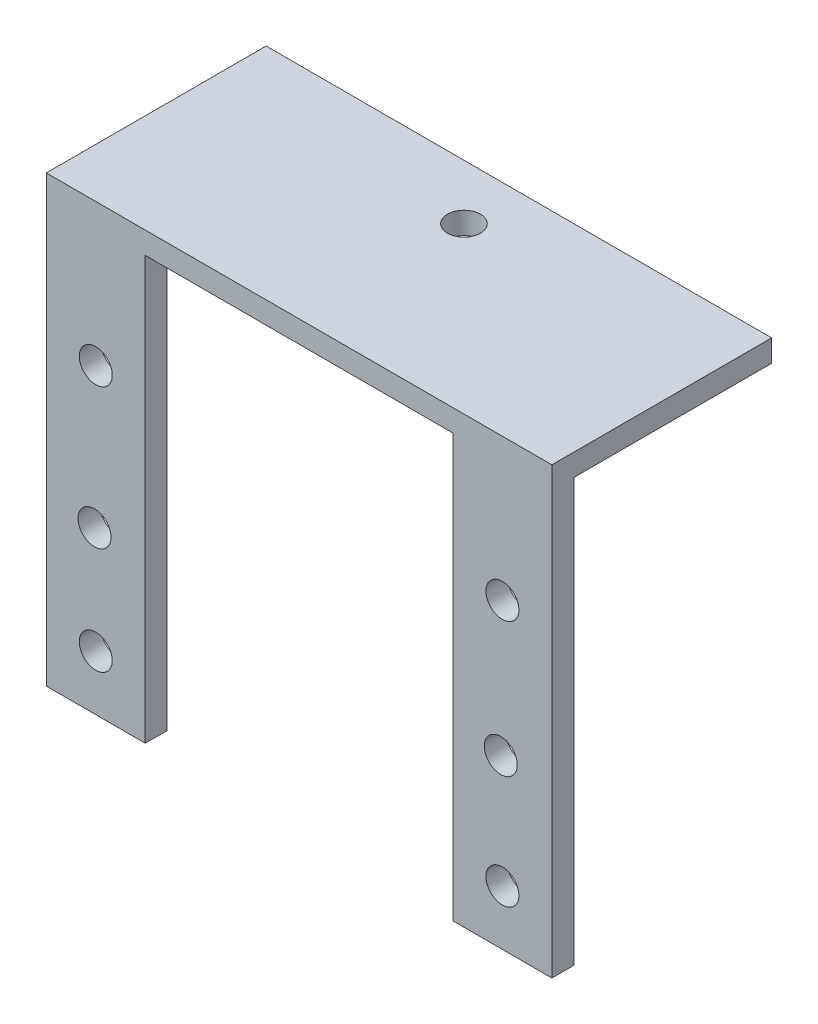
from build123d import *

# Parameters (mm, degrees)
SKETCH3_W             = 9
SKETCH3_H             = 40
SKETCH3_R             = 1.5
BOSS_EXTRUDE5_DEPTH   = 2
BOSS_EXTRUDE5_2_DEPTH = 2
SKETCH5_W             = 46
SKETCH5_H             = 20
SKETCH5_R             = 1.5
BOSS_EXTRUDE7_DEPTH   = 2
SKETCH6_R             = 1.5
CUT_EXTRUDE1_DEPTH    = 10
SKETCH7_R             = 1.5
CUT_EXTRUDE2_DEPTH    = 10


with BuildPart() as part:
    # Sketch3 → Boss-Extrude5 (new body)
    with BuildSketch(Plane.XY):
        with Locations((-21.015808288, -14.438328765)):
            Rectangle(SKETCH3_W, SKETCH3_H)
        with Locations((-21.015808288, -29.438328765)):
            Circle(SKETCH3_R, mode=Mode.SUBTRACT)
        with Locations((-21.015808288, -6.938328765)):
            Circle(SKETCH3_R, mode=Mode.SUBTRACT)
    extrude(amount=BOSS_EXTRUDE5_DEPTH)



with BuildPart() as body_2:
    # Sketch3 → Boss-Extrude5 2 (new body)
    with BuildSketch(Plane.XY):
        with Locations((15.984191712, -14.438328765)):
            Rectangle(SKETCH3_W, SKETCH3_H)
        with Locations((15.984191712, -29.438328765)):
            Circle(SKETCH3_R, mode=Mode.SUBTRACT)
        with Locations((15.984191712, -6.938328765)):
            Circle(SKETCH3_R, mode=Mode.SUBTRACT)
    extrude(amount=BOSS_EXTRUDE5_2_DEPTH)


with BuildPart() as part_1:
    add(part.part)

    add(body_2.part)  # Boss-Extrude7 merges body 2
    # Sketch5 → Boss-Extrude7 (add)
    with BuildSketch(Plane(origin=(0, 4, 0), x_dir=(1, 0, 0), z_dir=(0, 1, 0))):
        with Locations((-2.515808288, 8)):
            Rectangle(SKETCH5_W, SKETCH5_H)
        with Locations(Location((-2.515808288, 13, 0), (0, 0, 270))):
            Circle(SKETCH5_R, mode=Mode.SUBTRACT)
    extrude(amount=BOSS_EXTRUDE7_DEPTH)

    # Sketch6 → Cut-Extrude1 (cut)
    with BuildSketch(Plane.XY.offset(2)):
        with Locations((15.834091702, -19.231630496)):
            Circle(SKETCH6_R)
    extrude(amount=-CUT_EXTRUDE1_DEPTH, mode=Mode.SUBTRACT)

    # Sketch7 → Cut-Extrude2 (cut)
    with BuildSketch(Plane.XY.offset(2)):
        with Locations((-21.127531315, -19.770890517)):
            Circle(SKETCH7_R)
    extrude(amount=-CUT_EXTRUDE2_DEPTH, mode=Mode.SUBTRACT)


solid = part_1.part
